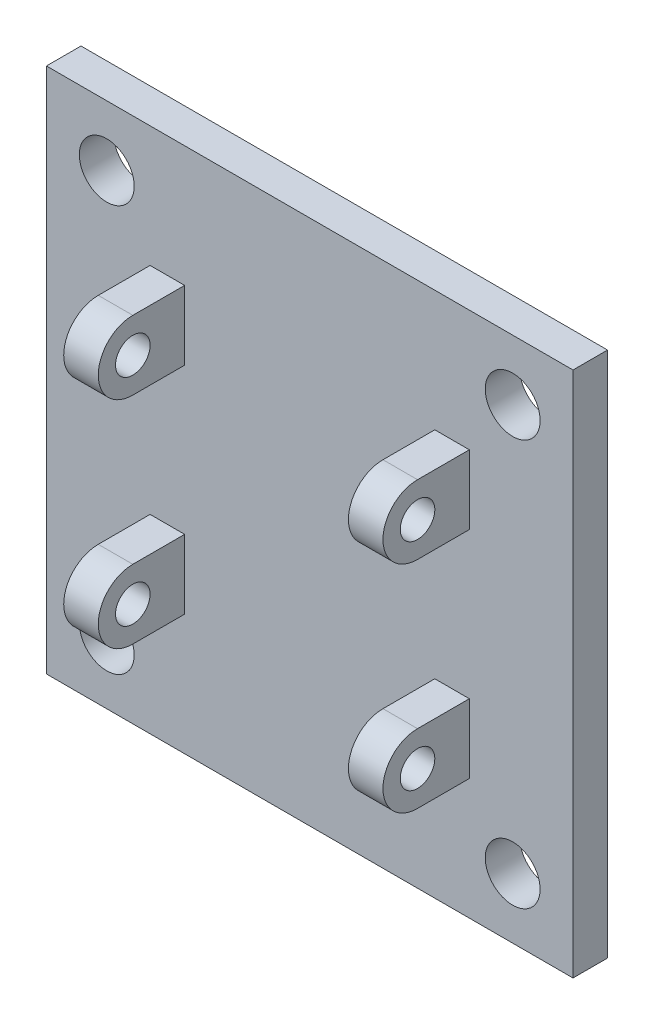
from build123d import *

# Parameters (mm, degrees)
CROQUIS1_W              = 152.4
CROQUIS1_H              = 152.4
SALIENTE_EXTRUIR1_DEPTH = 10
CROQUIS2_R              = 7.94
CORTAR_EXTRUIR1_DEPTH   = 216.758012597
CROQUIS4_R              = 5
SALIENTE_EXTRUIR2_DEPTH = 10


with BuildPart() as part:
    # Croquis1 → Saliente-Extruir1 (new body)
    with BuildSketch(Plane.XY):
        with Locations((76.2, 76.2)):
            Rectangle(CROQUIS1_W, CROQUIS1_H)
    extrude(amount=SALIENTE_EXTRUIR1_DEPTH)

    # Croquis2 → Cortar-Extruir1 (cut, through all)
    with BuildSketch(Plane.XY.offset(10)):
        with Locations((134.94, 17.46)):
            Circle(CROQUIS2_R)
        with Locations((17.46, 17.46)):
            Circle(CROQUIS2_R)
        with Locations(Location((134.94, 134.94, 0), (0, 0, 180))):
            Circle(CROQUIS2_R)
        with Locations(Location((17.46, 134.94, 0), (0, 0, 180))):
            Circle(CROQUIS2_R)
    extrude(amount=-CORTAR_EXTRUIR1_DEPTH, mode=Mode.SUBTRACT)

    # Croquis4 → Saliente-Extruir2 (add)
    # profile 1 of 2: a face of its own
    with BuildSketch(Plane.ZY.offset(-40)):
        with BuildLine():
            Line((10, 117.4), (25, 117.4))
            ThreePointArc((25, 117.4), (35, 107.4), (25, 97.4))
            Line((25, 97.4), (10, 97.4))
            Line((10, 97.4), (10, 117.4))
        make_face()
        with Locations((25, 107.4)):
            Circle(CROQUIS4_R, mode=Mode.SUBTRACT)
    # profile 2 of 2: a face of its own
    with BuildSketch(Plane.ZY.offset(-40)):
        with BuildLine():
            Line((25, 55), (10, 55))
            Line((10, 55), (10, 35))
            Line((10, 35), (25, 35))
            ThreePointArc((25, 35), (35, 45), (25, 55))
        make_face()
        with Locations(Location((25, 45, 0), (0, 0, 180))):
            Circle(CROQUIS4_R, mode=Mode.SUBTRACT)
    saliente_extruir2 = extrude(amount=SALIENTE_EXTRUIR2_DEPTH)

    # Simetría1: Saliente-Extruir2 across plane
    add(saliente_extruir2.mirror(Plane.ZY.offset(-76.2)))


solid = part.part
